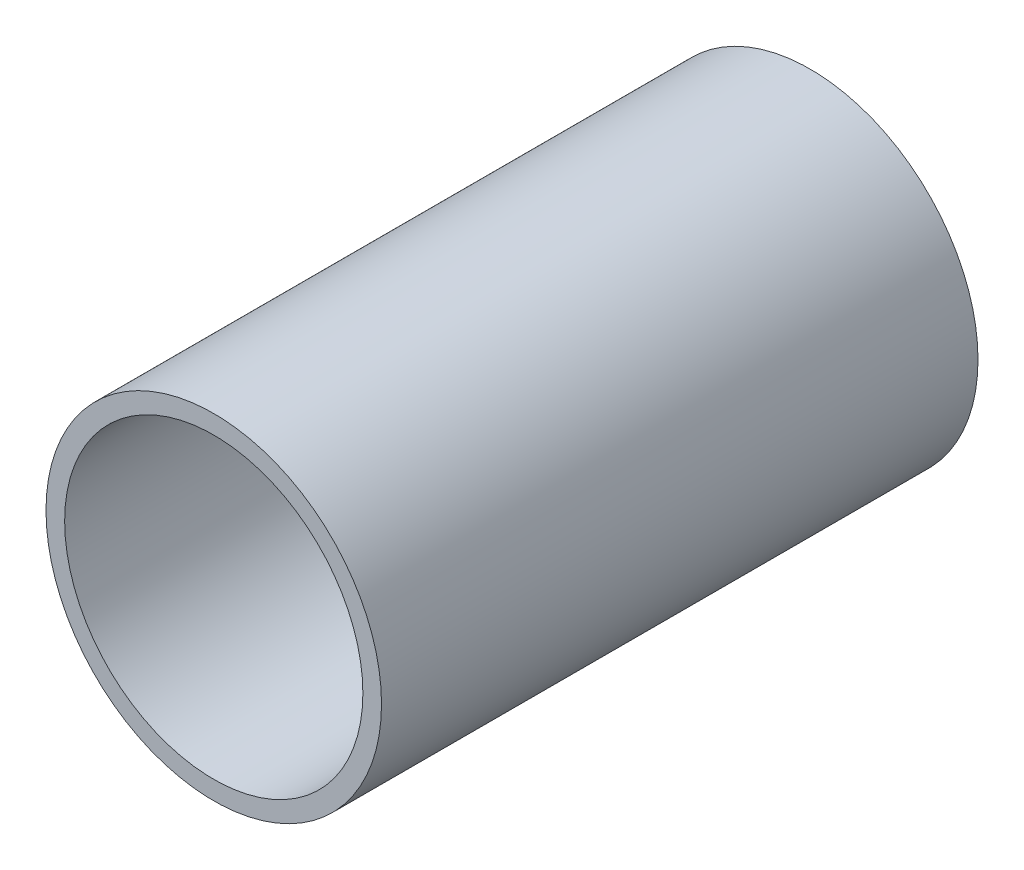
from build123d import *

# Parameters (mm, degrees)
SKETCH1_R           = 57.15
SKETCH1_R_2         = 50.8
BOSS_EXTRUDE1_DEPTH = 101.6


with BuildPart() as part:
    # Sketch1 → Boss-Extrude1 (new, symmetric)
    with BuildSketch(Plane.XY):
        Circle(SKETCH1_R)
        Circle(SKETCH1_R_2, mode=Mode.SUBTRACT)
    extrude(amount=BOSS_EXTRUDE1_DEPTH, both=True)


solid = part.part
